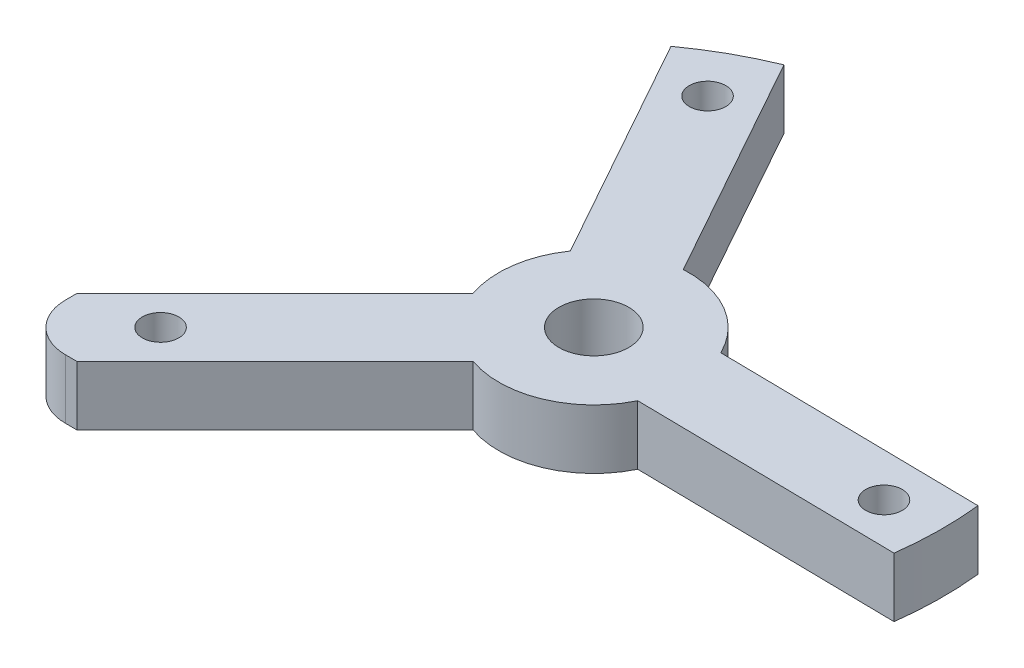
from build123d import *

# Parameters (mm, degrees)
SKETCH2_R           = 2.4384
SKETCH2_R_2         = 4.66725
BOSS_EXTRUDE1_DEPTH = 7.9375


with BuildPart() as part:
    # Sketch2 → Boss-Extrude1 (new body)
    with BuildSketch(Plane(origin=(0, 0, 0), x_dir=(1, 0, 0), z_dir=(0, 1, 0))):
        with BuildLine():
            Line((55.590698865, -86.917376556), (57.091379829, -86.917376556))
            Line((57.091379829, -86.917376556), (83.572039589, -60.436716796))
            ThreePointArc((83.572039589, -60.436716796), (92.583392677, -60.167850758), (99.145825273, -53.986325716))
            Line((99.145825273, -53.986325716), (133.917161076, -54.4991448))
            ThreePointArc((133.917161076, -54.4991448), (134.310699941, -48.951866676), (134.040463462, -43.397216403))
            Line((134.040463462, -43.397216403), (99.145825273, -42.882578814))
            ThreePointArc((99.145825273, -42.882578814), (94.154259421, -37.482880814), (87.006822934, -35.754696848))
            Line((87.006822934, -35.754696848), (70.035827706, -5.332650295))
            ThreePointArc((70.035827706, -5.332650295), (65.026183263, -7.747234822), (60.339928944, -10.741525445))
            Line((60.339928944, -10.741525445), (77.310924172, -41.163571998))
            ThreePointArc((77.310924172, -41.163571998), (75.144838741, -46.683971579), (75.721358625, -52.586035832))
            Line((75.721358625, -52.586035832), (49.240698865, -79.066695593))
            Line((49.240698865, -79.066695593), (49.240698865, -80.567376556))
            ThreePointArc((49.240698865, -80.567376556), (51.100570805, -85.057504617), (55.590698865, -86.917376556))
        make_face()
        with Locations(Location((58.765698865, -77.392376556, 0), (0, 0, 270))):
            Circle(SKETCH2_R, mode=Mode.SUBTRACT)
        with Locations(Location((87.723623157, -48.434452265, 0), (0, 0, 270))):
            Circle(SKETCH2_R_2, mode=Mode.SUBTRACT)
        with Locations(Location((127.089342108, -49.015030821, 0), (0, 0, 270))):
            Circle(SKETCH2_R, mode=Mode.SUBTRACT)
        with Locations(Location((68.54355946, -14.052450337, 0), (0, 0, 270))):
            Circle(SKETCH2_R, mode=Mode.SUBTRACT)
    extrude(amount=BOSS_EXTRUDE1_DEPTH)


solid = part.part
